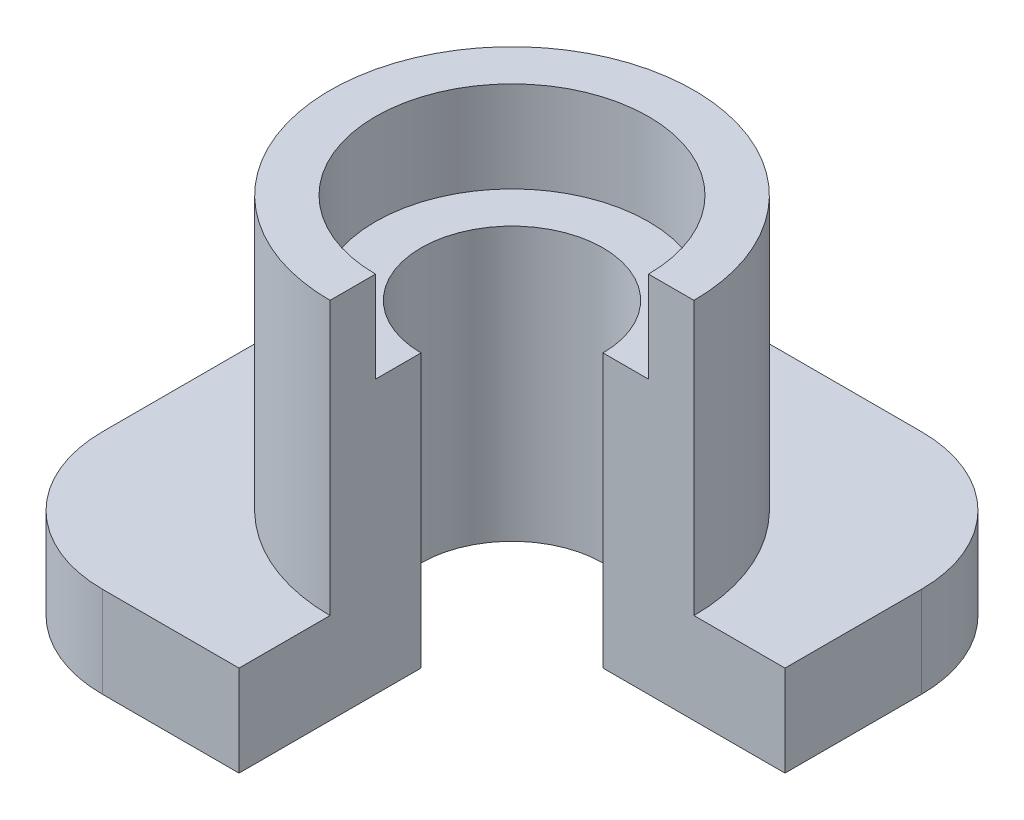
from build123d import *

# Parameters (mm, degrees)
SALIENTE_EXTRUIR1_DEPTH = 20
CROQUIS2_R              = 40
SALIENTE_EXTRUIR2_DEPTH = 60
CROQUIS3_R              = 30
CORTAR_EXTRUIR1_DEPTH   = 20
CROQUIS4_R              = 20
CORTAR_EXTRUIR2_DEPTH   = 104.923048454
CROQUIS6_W              = 71.704078793
CROQUIS6_H              = 65.206875147
CORTAR_EXTRUIR4_DEPTH   = 117.619037897


with BuildPart() as part:
    # Croquis1 → Saliente-Extruir1 (new body)
    with BuildSketch(Plane(origin=(0, 0, 0), x_dir=(1, 0, 0), z_dir=(0, 1, 0))):
        with BuildLine():
            Line((-30, 60), (30, 60))
            ThreePointArc((30, 60), (51.213203436, 51.213203436), (60, 30))
            Line((60, 30), (60, -30))
            ThreePointArc((60, -30), (51.213203436, -51.213203436), (30, -60))
            Line((30, -60), (-30, -60))
            ThreePointArc((-30, -60), (-51.213203436, -51.213203436), (-60, -30))
            Line((-60, -30), (-60, 30))
            ThreePointArc((-60, 30), (-51.213203436, 51.213203436), (-30, 60))
        make_face()
    extrude(amount=SALIENTE_EXTRUIR1_DEPTH)

    # Croquis2 → Saliente-Extruir2 (add)
    with BuildSketch(Plane(origin=(0, 20, 0), x_dir=(1, 0, 0), z_dir=(0, 1, 0))):
        with Locations(Location((0, 0, 0), (0, 0, 90))):
            Circle(CROQUIS2_R)
    extrude(amount=SALIENTE_EXTRUIR2_DEPTH)

    # Croquis3 → Cortar-Extruir1 (cut)
    with BuildSketch(Plane(origin=(0, 80, 0), x_dir=(1, 0, 0), z_dir=(0, 1, 0))):
        with Locations(Location((0, 0, 0), (0, 0, 270))):
            Circle(CROQUIS3_R)
    extrude(amount=-CORTAR_EXTRUIR1_DEPTH, mode=Mode.SUBTRACT)

    # Croquis4 → Cortar-Extruir2 (cut, through all)
    with BuildSketch(Plane(origin=(0, 60, 0), x_dir=(1, 0, 0), z_dir=(0, 1, 0))):
        with Locations(Location((0, 0, 0), (0, 0, 270))):
            Circle(CROQUIS4_R)
    extrude(amount=-CORTAR_EXTRUIR2_DEPTH, mode=Mode.SUBTRACT)

    # Croquis6 → Cortar-Extruir4 (cut, through all)
    with BuildSketch(Plane(origin=(0, 80, 0), x_dir=(1, 0, 0), z_dir=(0, 1, 0))):
        with Locations((35.852039397, -32.603437574)):
            Rectangle(CROQUIS6_W, CROQUIS6_H)
    extrude(amount=-CORTAR_EXTRUIR4_DEPTH, mode=Mode.SUBTRACT)


solid = part.part
